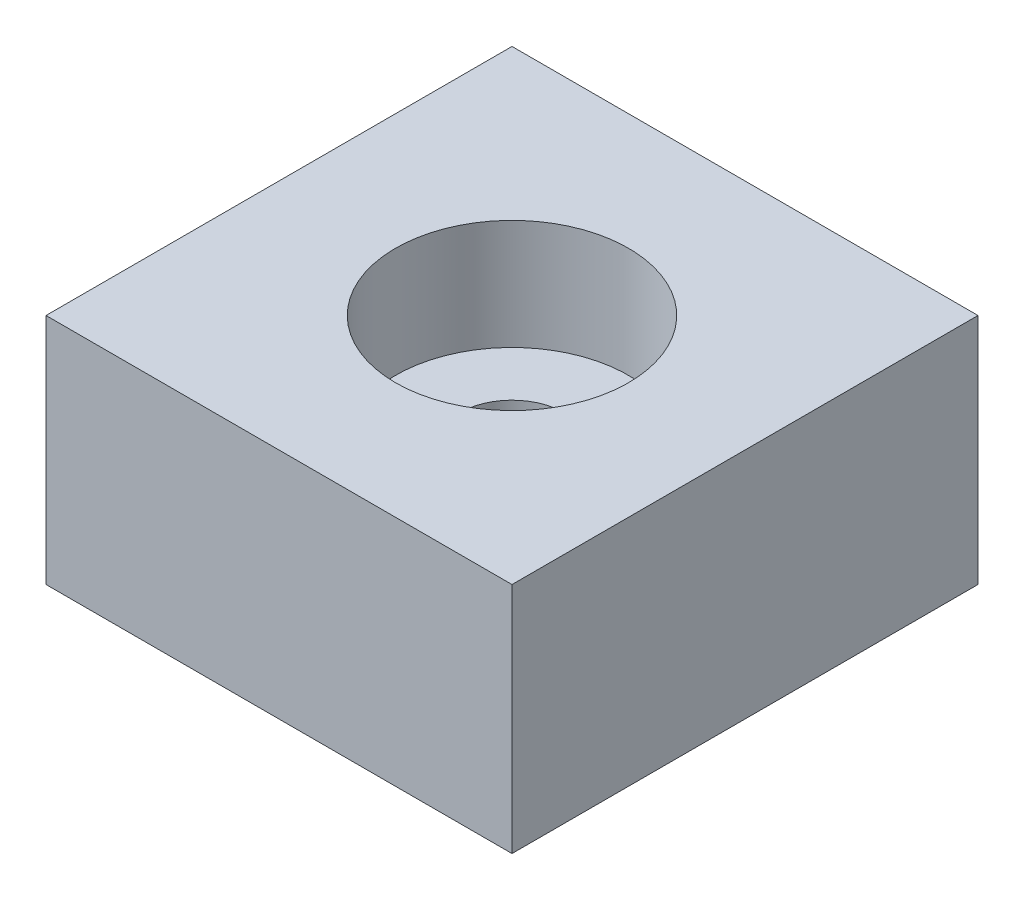
from build123d import *

# Parameters (mm, degrees)
SKETCH1_W              = 38.1
SKETCH1_H              = 38.1
BOSS_EXTRUDE1_DEPTH    = 19.05
M10X1_5_TAPPED_HOLE1_D = 8.5
SKETCH5_R              = 9.525
CUT_EXTRUDE1_DEPTH     = 9


with BuildPart() as part:
    # Sketch1 → Boss-Extrude1 (new body)
    with BuildSketch(Plane(origin=(0, 0, 0), x_dir=(1, 0, 0), z_dir=(0, 1, 0))):
        Rectangle(SKETCH1_W, SKETCH1_H)
    extrude(amount=BOSS_EXTRUDE1_DEPTH)

    # M10x1.5 Tapped Hole1 (through all)
    with Locations(Plane(origin=(0, 19.05, 0), x_dir=(1, 0, 0), z_dir=(0, 1, 0))):
        with Locations((0, 0)):
            Hole(M10X1_5_TAPPED_HOLE1_D / 2)

    # Sketch5 → Cut-Extrude1 (cut)
    with BuildSketch(Plane(origin=(0, 19.05, 0), x_dir=(1, 0, 0), z_dir=(0, 1, 0))):
        with Locations(Location((0, 0, 0), (0, 0, 270))):
            Circle(SKETCH5_R)
    extrude(amount=-CUT_EXTRUDE1_DEPTH, mode=Mode.SUBTRACT)


solid = part.part
